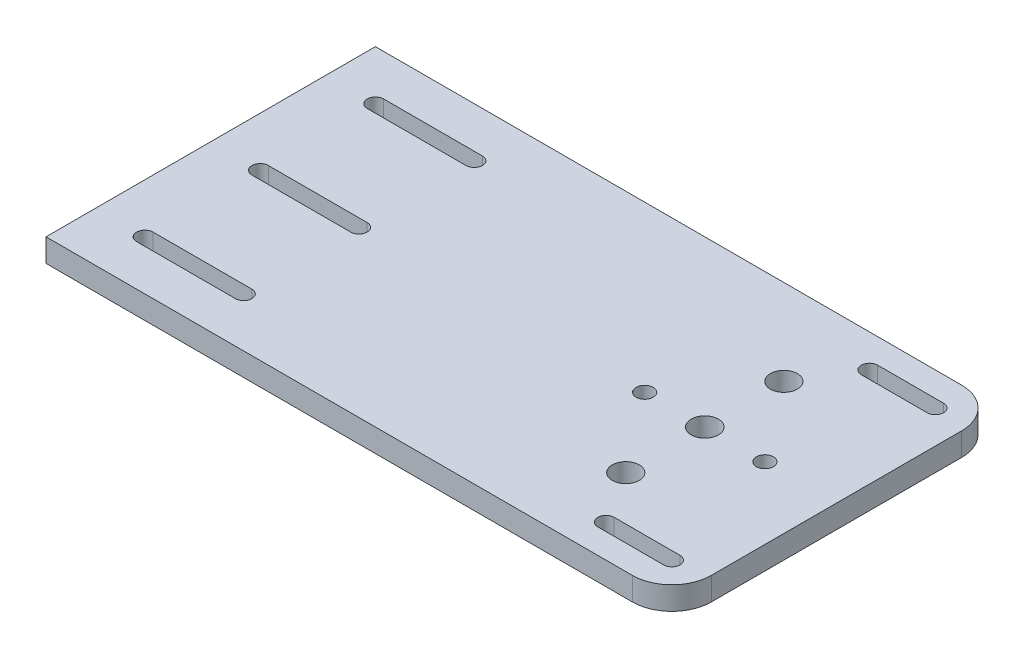
from build123d import *

# Parameters (mm, degrees)
SKETCH1_W           = 190
SKETCH1_H           = 100
SKETCH1_R           = 4.15
SKETCH1_R_2         = 4.1
SKETCH1_R_3         = 2.6
BOSS_EXTRUDE1_DEPTH = 7
FILLET3_R           = 12


with BuildPart() as part:
    # Sketch1 → Boss-Extrude1 (new body)
    with BuildSketch(Plane(origin=(0, 0, 0), x_dir=(1, 0, 0), z_dir=(0, 1, 0))):
        with Locations((95, 50)):
            Rectangle(SKETCH1_W, SKETCH1_H)
        with Locations(Location((150, 50, 0), (0, 0, 270))):
            Circle(SKETCH1_R, mode=Mode.SUBTRACT)
        with Locations(Location((150, 74, 0), (0, 0, 270))):
            Circle(SKETCH1_R_2, mode=Mode.SUBTRACT)
        with Locations(Location((131.75, 50, 0), (0, 0, 270))):
            Circle(SKETCH1_R_3, mode=Mode.SUBTRACT)
        with Locations(Location((168.25, 50, 0), (0, 0, 270))):
            Circle(SKETCH1_R_3, mode=Mode.SUBTRACT)
        with Locations(Location((150, 26, 0), (0, 0, 270))):
            Circle(SKETCH1_R_2, mode=Mode.SUBTRACT)
        with BuildLine():
            Line((160, 12.5), (180, 12.5))
            ThreePointArc((180, 12.5), (182.5, 10), (180, 7.5))
            Line((180, 7.5), (160, 7.5))
            ThreePointArc((160, 7.5), (157.5, 10), (160, 12.5))
        make_face(mode=Mode.SUBTRACT)
        with BuildLine():
            Line((160, 87.5), (180, 87.5))
            ThreePointArc((180, 87.5), (182.5, 90), (180, 92.5))
            Line((180, 92.5), (160, 92.5))
            ThreePointArc((160, 92.5), (157.5, 90), (160, 87.5))
        make_face(mode=Mode.SUBTRACT)
        with BuildLine():
            Line((15, 87.5), (45, 87.5))
            ThreePointArc((45, 87.5), (47.5, 85), (45, 82.5))
            Line((45, 82.5), (15, 82.5))
            ThreePointArc((15, 82.5), (12.5, 85), (15, 87.5))
        make_face(mode=Mode.SUBTRACT)
        with BuildLine():
            Line((15, 52.5), (45, 52.5))
            ThreePointArc((45, 52.5), (47.5, 50), (45, 47.5))
            Line((45, 47.5), (15, 47.5))
            ThreePointArc((15, 47.5), (12.5, 50), (15, 52.5))
        make_face(mode=Mode.SUBTRACT)
        with BuildLine():
            Line((15, 17.5), (45, 17.5))
            ThreePointArc((45, 17.5), (47.5, 15), (45, 12.5))
            Line((45, 12.5), (15, 12.5))
            ThreePointArc((15, 12.5), (12.5, 15), (15, 17.5))
        make_face(mode=Mode.SUBTRACT)
    extrude(amount=BOSS_EXTRUDE1_DEPTH)

    # Fillet3
    fillet3_edges = [part.edges().sort_by_distance(p)[0] for p in [
        (190, 3.5, -100),
        (190, 3.5, 0),
    ]]
    fillet(fillet3_edges, radius=FILLET3_R)


solid = part.part
